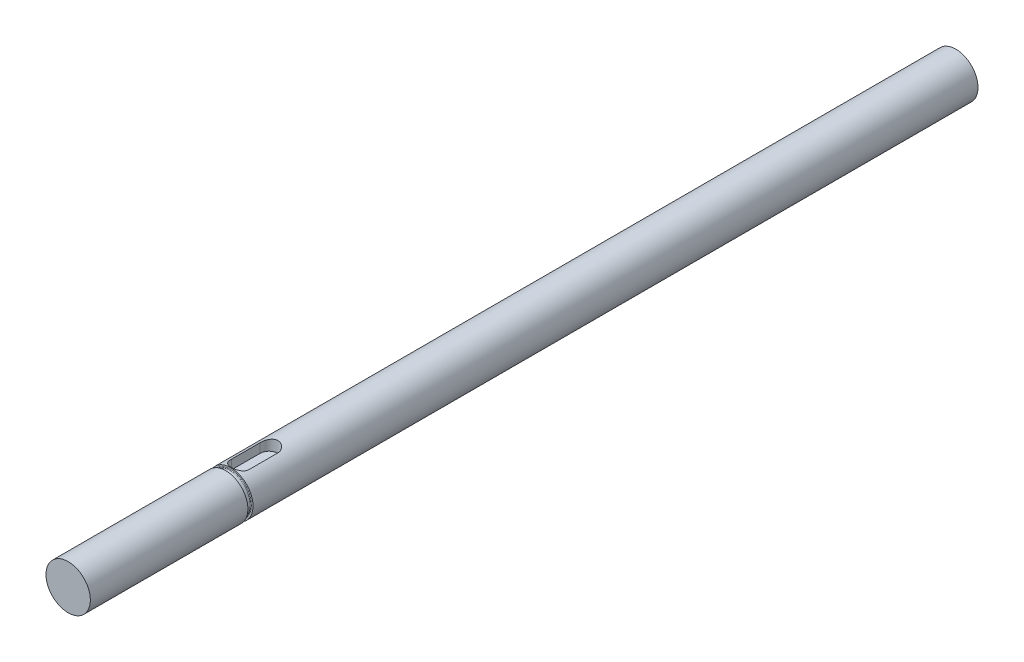
from build123d import *

# Parameters (mm, degrees)
CROQUIS1_R              = 5
SALIENTE_EXTRUIR1_DEPTH = 100
CORTAR_EXTRUIR1_START   = 2.5
CORTAR_EXTRUIR1_DEPTH   = 98.749688279


with BuildPart() as part:
    # Croquis1 → Saliente-Extruir1 (new, symmetric)
    with BuildSketch(Plane.XY):
        Circle(CROQUIS1_R)
    extrude(amount=SALIENTE_EXTRUIR1_DEPTH, both=True)

    # Croquis2 → Cortar-Extruir1 (cut, through all)
    with BuildSketch(Plane(origin=(0, 0, 0), x_dir=(1, 0, 0), z_dir=(0, 1, 0)).offset(CORTAR_EXTRUIR1_START)):
        with BuildLine():
            Line((2, -54.75), (2, -61.25))
            ThreePointArc((2, -61.25), (0, -63.25), (-2, -61.25))
            Line((-2, -61.25), (-2, -54.75))
            ThreePointArc((-2, -54.75), (0, -52.75), (2, -54.75))
        make_face()
    extrude(amount=CORTAR_EXTRUIR1_DEPTH, mode=Mode.SUBTRACT)

    # Croquis4 → Ranura para arandela de seguridad para ejes DIN 6799 - 91 (revolve, cut)
    with BuildSketch(Plane(origin=(0, 0, 100), x_dir=(0, 1, 0), z_dir=(-1, 0, 0))):
        with BuildLine():
            Line((4.65, 35.5), (6.641427447, 35.5))
            Line((6.641427447, 35.5), (6.641427447, 36.65))
            Line((6.641427447, 36.65), (4.65, 36.65))
            ThreePointArc((4.65, 36.65), (4.543933983, 36.606066017), (4.5, 36.5))
            Line((4.5, 36.5), (4.5, 35.65))
            ThreePointArc((4.5, 35.65), (4.543933983, 35.543933983), (4.65, 35.5))
        make_face()
    revolve(axis=Axis((0, 0, 150), (0, 0, -1)), mode=Mode.SUBTRACT)


solid = part.part
